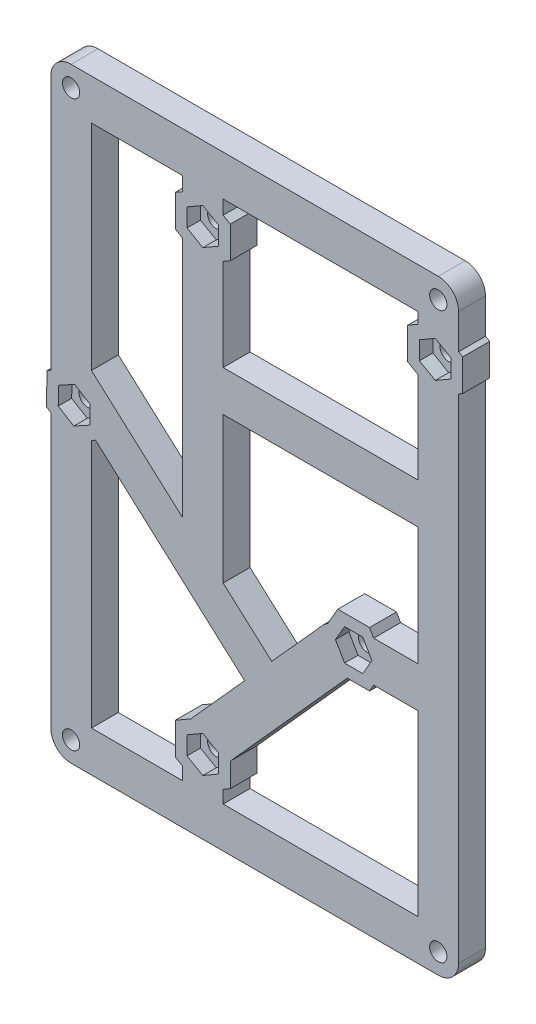
from build123d import *
from build123d.topology import SkipClean

# Parameters (mm, degrees)
SKETCH4_R             = 3.475
SKETCH4_R_2           = 1.475
BOSS_EXTRUDE3_DEPTH   = 2.3
BOSS_EXTRUDE3_2_DEPTH = 2.3
BOSS_EXTRUDE3_3_DEPTH = 2.3
BOSS_EXTRUDE3_4_DEPTH = 2.3
SKETCH2_R             = 3.475
SKETCH2_R_2           = 1.475
BOSS_EXTRUDE4_DEPTH   = 2.3
BOSS_EXTRUDE4_2_DEPTH = 2.3
BOSS_EXTRUDE4_3_DEPTH = 2.3
BOSS_EXTRUDE4_4_DEPTH = 2.3
BOSS_EXTRUDE4_5_DEPTH = 2.3
SKETCH5_R             = 1.475
SKETCH5_R_2           = 3.475
BOSS_EXTRUDE8_DEPTH   = 2.3
BOSS_EXTRUDE9_DEPTH   = 2.3
BOSS_EXTRUDE10_DEPTH  = 2.3
BOSS_EXTRUDE11_DEPTH  = 2.3
BOSS_EXTRUDE12_DEPTH  = 2.3
SKETCH12_W            = 33.31
SKETCH12_H            = 6.95
BOSS_EXTRUDE13_DEPTH  = 2.3
CUT_EXTRUDE1_DEPTH    = 10
BOSS_EXTRUDE15_START  = 2.3
SKETCH16_R            = 3.475
SKETCH16_R_2          = 1.475
BOSS_EXTRUDE15_DEPTH  = 2.3
BOSS_EXTRUDE16_DEPTH  = 2.3
BOSS_EXTRUDE17_START  = 2.3
SKETCH18_R            = 3.475
SKETCH18_R_2          = 1.475
BOSS_EXTRUDE17_DEPTH  = 2.3
CUT_EXTRUDE2_DEPTH    = 2.3
BOSS_EXTRUDE18_DEPTH  = 2.3
BOSS_EXTRUDE19_START  = 2.3
SKETCH22_R            = 1.475
SKETCH22_R_2          = 3.475
BOSS_EXTRUDE19_DEPTH  = 2.3


with BuildPart() as part:
    # Sketch4 → Boss-Extrude3 (new body)
    with BuildSketch(Plane.XY):
        with Locations((-62.78, 96.55)):
            Circle(SKETCH4_R)
        with Locations((-62.78, 96.55)):
            Circle(SKETCH4_R_2, mode=Mode.SUBTRACT)
    extrude(amount=BOSS_EXTRUDE3_DEPTH)



with BuildPart() as body_2:
    # Sketch4 → Boss-Extrude3 2 (new body)
    with BuildSketch(Plane.XY):
        with Locations((0, 96.55)):
            Circle(SKETCH4_R)
        with Locations((0, 96.55)):
            Circle(SKETCH4_R_2, mode=Mode.SUBTRACT)
    extrude(amount=BOSS_EXTRUDE3_2_DEPTH)


with BuildPart() as body_3:
    # Sketch4 → Boss-Extrude3 3 (new body)
    with BuildSketch(Plane.XY):
        with Locations((-62.78, 0)):
            Circle(SKETCH4_R)
        with Locations((-62.78, 0)):
            Circle(SKETCH4_R_2, mode=Mode.SUBTRACT)
    extrude(amount=BOSS_EXTRUDE3_3_DEPTH)


with BuildPart() as body_4:
    # Sketch4 → Boss-Extrude3 4 (new body)
    with BuildSketch(Plane.XY):
        Circle(SKETCH4_R)
        Circle(SKETCH4_R_2, mode=Mode.SUBTRACT)
    extrude(amount=BOSS_EXTRUDE3_4_DEPTH)


with BuildPart() as body_5:
    # Sketch2 → Boss-Extrude4 (new body)
    with BuildSketch(Plane.XY):
        with Locations((-14.46, 37.44)):
            Circle(SKETCH2_R)
        with Locations((-14.46, 37.44)):
            Circle(SKETCH2_R_2, mode=Mode.SUBTRACT)
    extrude(amount=BOSS_EXTRUDE4_DEPTH)


with BuildPart() as body_6:
    # Sketch2 → Boss-Extrude4 2 (new body)
    with BuildSketch(Plane.XY):
        with Locations((-0.52, 87.46)):
            Circle(SKETCH2_R)
        with Locations((-0.52, 87.46)):
            Circle(SKETCH2_R_2, mode=Mode.SUBTRACT)
    extrude(amount=BOSS_EXTRUDE4_2_DEPTH)


with BuildPart() as body_7:
    # Sketch2 → Boss-Extrude4 3 (new body)
    with BuildSketch(Plane.XY):
        with Locations((-40.26, 87.26)):
            Circle(SKETCH2_R)
        with Locations((-40.26, 87.26)):
            Circle(SKETCH2_R_2, mode=Mode.SUBTRACT)
    extrude(amount=BOSS_EXTRUDE4_3_DEPTH)


with BuildPart() as body_8:
    # Sketch2 → Boss-Extrude4 4 (new body)
    with BuildSketch(Plane.XY):
        with Locations((-40.26, 9.09)):
            Circle(SKETCH2_R)
        with Locations((-40.26, 9.09)):
            Circle(SKETCH2_R_2, mode=Mode.SUBTRACT)
    extrude(amount=BOSS_EXTRUDE4_4_DEPTH)


with BuildPart() as body_9:
    # Sketch2 → Boss-Extrude4 5 (new body)
    with BuildSketch(Plane.XY):
        with Locations((-62.25, 49.81)):
            Circle(SKETCH2_R)
        with Locations((-62.25, 49.81)):
            Circle(SKETCH2_R_2, mode=Mode.SUBTRACT)
    extrude(amount=BOSS_EXTRUDE4_5_DEPTH)


with BuildPart() as part_1:
    add(part.part)

    add(body_2.part)  # Boss-Extrude8 merges body 2

    add(body_3.part)  # Boss-Extrude8 merges body 3

    add(body_4.part)  # Boss-Extrude8 merges body 4

    add(body_6.part)  # Boss-Extrude8 merges body 6

    add(body_9.part)  # Boss-Extrude8 merges body 9
    # Sketch5 → Boss-Extrude8 (add)
    # profile 1 of 12: a face of its own
    with BuildSketch(Plane(origin=(0, 0, 0), x_dir=(-1, 0, 0), z_dir=(0, 0, -1))):
        with BuildLine():
            ThreePointArc((0, 93.075), (-2.457196065, 94.092803935), (-3.475, 96.55))
            Line((-3.475, 96.55), (-3.475, 0))
            ThreePointArc((-3.475, 0), (-2.457196065, 2.457196065), (0, 3.475))
            Line((0, 3.475), (3.475, 3.475))
            Line((3.475, 3.475), (3.475, 93.075))
            Line((3.475, 93.075), (0, 93.075))
        make_face()
        with Locations((0.52, 87.46)):
            Circle(SKETCH5_R, mode=Mode.SUBTRACT)
    # profile 2 of 12: a face of its own
    with BuildSketch(Plane(origin=(0, 0, 0), x_dir=(-1, 0, 0), z_dir=(0, 0, -1))):
        with BuildLine():
            Line((62.78, 100.025), (0, 100.025))
            ThreePointArc((0, 100.025), (2.457196065, 99.007196065), (3.475, 96.55))
            Line((3.475, 96.55), (3.475, 93.075))
            Line((3.475, 93.075), (59.305, 93.075))
            Line((59.305, 93.075), (59.305, 96.55))
            ThreePointArc((59.305, 96.55), (60.322803935, 99.007196065), (62.78, 100.025))
        make_face()
    # profile 3 of 12: a face of its own
    with BuildSketch(Plane(origin=(0, 0, 0), x_dir=(-1, 0, 0), z_dir=(0, 0, -1))):
        with BuildLine():
            Line((66.255, 0), (66.255, 96.55))
            ThreePointArc((66.255, 96.55), (65.237196065, 94.092803935), (62.78, 93.075))
            Line((62.78, 93.075), (59.305, 93.075))
            Line((59.305, 93.075), (59.305, 3.475))
            Line((59.305, 3.475), (62.78, 3.475))
            ThreePointArc((62.78, 3.475), (65.237196065, 2.457196065), (66.255, 0))
        make_face()
        with Locations((62.25, 49.81)):
            Circle(SKETCH5_R, mode=Mode.SUBTRACT)
    # profile 4 of 12: a face of its own
    with BuildSketch(Plane(origin=(0, 0, 0), x_dir=(-1, 0, 0), z_dir=(0, 0, -1))):
        with BuildLine():
            ThreePointArc((3.475, 0), (2.457196065, -2.457196065), (0, -3.475))
            Line((0, -3.475), (62.78, -3.475))
            ThreePointArc((62.78, -3.475), (60.322803935, -2.457196065), (59.305, 0))
            Line((59.305, 0), (59.305, 3.475))
            Line((59.305, 3.475), (3.475, 3.475))
            Line((3.475, 3.475), (3.475, 0))
        make_face()
    # profile 5 of 12: a face of its own
    with BuildSketch(Plane(origin=(0, 0, 0), x_dir=(-1, 0, 0), z_dir=(0, 0, -1))):
        with BuildLine():
            ThreePointArc((3.475, 96.55), (2.457196065, 94.092803935), (0, 93.075))
            Line((0, 93.075), (3.475, 93.075))
            Line((3.475, 93.075), (3.475, 96.55))
        make_face()
    # profile 6 of 12: a face of its own
    with BuildSketch(Plane(origin=(0, 0, 0), x_dir=(-1, 0, 0), z_dir=(0, 0, -1))):
        with BuildLine():
            ThreePointArc((62.78, 93.075), (60.322803935, 94.092803935), (59.305, 96.55))
            Line((59.305, 96.55), (59.305, 93.075))
            Line((59.305, 93.075), (62.78, 93.075))
        make_face()
    # profile 7 of 12: a face of its own
    with BuildSketch(Plane(origin=(0, 0, 0), x_dir=(-1, 0, 0), z_dir=(0, 0, -1))):
        with Locations((0, 96.55)):
            Circle(SKETCH5_R_2)
        with Locations((0, 96.55)):
            Circle(SKETCH5_R, mode=Mode.SUBTRACT)
    # profile 8 of 12: a face of its own
    with BuildSketch(Plane(origin=(0, 0, 0), x_dir=(-1, 0, 0), z_dir=(0, 0, -1))):
        with Locations((62.78, 96.55)):
            Circle(SKETCH5_R_2)
        with Locations(Location((62.78, 96.55, 0), (0, 0, 180))):
            Circle(SKETCH5_R, mode=Mode.SUBTRACT)
    # profile 9 of 12: a face of its own
    with BuildSketch(Plane(origin=(0, 0, 0), x_dir=(-1, 0, 0), z_dir=(0, 0, -1))):
        Circle(SKETCH5_R_2)
        Circle(SKETCH5_R, mode=Mode.SUBTRACT)
    # profile 10 of 12: a face of its own
    with BuildSketch(Plane(origin=(0, 0, 0), x_dir=(-1, 0, 0), z_dir=(0, 0, -1))):
        with BuildLine():
            Line((3.475, 3.475), (0, 3.475))
            ThreePointArc((0, 3.475), (2.457196065, 2.457196065), (3.475, 0))
            Line((3.475, 0), (3.475, 3.475))
        make_face()
    # profile 11 of 12: a face of its own
    with BuildSketch(Plane(origin=(0, 0, 0), x_dir=(-1, 0, 0), z_dir=(0, 0, -1))):
        with Locations((62.78, 0)):
            Circle(SKETCH5_R_2)
        with Locations((62.78, 0)):
            Circle(SKETCH5_R, mode=Mode.SUBTRACT)
    # profile 12 of 12: a face of its own
    with BuildSketch(Plane(origin=(0, 0, 0), x_dir=(-1, 0, 0), z_dir=(0, 0, -1))):
        with BuildLine():
            Line((62.78, 3.475), (59.305, 3.475))
            Line((59.305, 3.475), (59.305, 0))
            ThreePointArc((59.305, 0), (60.322803935, 2.457196065), (62.78, 3.475))
        make_face()
    extrude(amount=-BOSS_EXTRUDE8_DEPTH)


    add(body_5.part)  # Boss-Extrude9 merges body 5

    add(body_7.part)  # Boss-Extrude9 merges body 7

    add(body_8.part)  # Boss-Extrude9 merges body 8
    # Sketch7 → Boss-Extrude9 (add)
    with BuildSketch(Plane(origin=(0, 0, 0), x_dir=(-1, 0, 0), z_dir=(0, 0, -1))):
        with BuildLine():
            Line((36.785, 93.075), (36.785, 87.26))
            ThreePointArc((36.785, 87.26), (40.26, 90.735), (43.735, 87.26))
            Line((43.735, 87.26), (43.735, 93.075))
            Line((43.735, 93.075), (36.785, 93.075))
        make_face()
        with BuildLine():
            Line((3.475, 33.965), (14.46, 33.965))
            ThreePointArc((14.46, 33.965), (10.985, 37.44), (14.46, 40.915))
            Line((14.46, 40.915), (3.475, 40.915))
            Line((3.475, 40.915), (3.475, 33.965))
        make_face()
        with BuildLine():
            Line((43.735, 3.475), (43.735, 9.09))
            ThreePointArc((43.735, 9.09), (40.26, 5.615), (36.785, 9.09))
            Line((36.785, 9.09), (36.785, 3.475))
            Line((36.785, 3.475), (43.735, 3.475))
        make_face()
    extrude(amount=-BOSS_EXTRUDE9_DEPTH)

    # Sketch8 → Boss-Extrude10 (add)
    with BuildSketch(Plane(origin=(0, 0, 0), x_dir=(-1, 0, 0), z_dir=(0, 0, -1))):
        with BuildLine():
            Line((14.46, 33.965), (36.785, 9.09))
            ThreePointArc((36.785, 9.09), (39.654572859, 12.511853734), (43.524040562, 10.282335611))
            ThreePointArc((43.524040562, 10.282335611), (42.905573582, 12.082105699), (41.957351355, 13.732120362))
            Line((41.957351355, 13.732120362), (19.632351355, 38.607120362))
            ThreePointArc((19.632351355, 38.607120362), (17.841296787, 39.827777652), (15.829298749, 40.633845008))
            ThreePointArc((15.829298749, 40.633845008), (17.863985635, 36.741067386), (14.46, 33.965))
        make_face()
    extrude(amount=-BOSS_EXTRUDE10_DEPTH)

    # Sketch9 → Boss-Extrude11 (add)
    with BuildSketch(Plane(origin=(0, 0, 0), x_dir=(-1, 0, 0), z_dir=(0, 0, -1))):
        with BuildLine():
            Line((59.305, 56.426418634), (28.473791174, 28.75579604))
            Line((28.473791174, 28.75579604), (33.115911536, 23.583444684))
            Line((33.115911536, 23.583444684), (59.305, 47.087822572))
            Line((59.305, 47.087822572), (59.305, 47.965386219))
            ThreePointArc((59.305, 47.965386219), (58.775, 49.81), (59.305, 51.654613781))
            Line((59.305, 51.654613781), (59.305, 56.426418634))
        make_face()
    extrude(amount=-BOSS_EXTRUDE11_DEPTH)

    # Sketch10 → Boss-Extrude12 (add)
    with BuildSketch(Plane(origin=(0, 0, 0), x_dir=(-1, 0, 0), z_dir=(0, 0, -1))):
        with BuildLine():
            ThreePointArc((43.735, 87.26), (40.26, 83.785), (36.785, 87.26))
            Line((36.785, 87.26), (36.785, 36.215001549))
            Line((36.785, 36.215001549), (43.735, 42.452539237))
            Line((43.735, 42.452539237), (43.735, 87.26))
        make_face()
    extrude(amount=-BOSS_EXTRUDE12_DEPTH)

    # Sketch12 → Boss-Extrude13 (add)
    with BuildSketch(Plane.XY.offset(2.3)):
        with Locations((-20.13, 64.645000774)):
            Rectangle(SKETCH12_W, SKETCH12_H)
    extrude(amount=-BOSS_EXTRUDE13_DEPTH)

    # Sketch13 → Cut-Extrude1 (cut)
    with BuildSketch(Plane.XY.offset(2.3)):
        Polygon((-11.342308546, 37.44), (-12.901154273, 40.14), (-16.018845727, 40.14), (-17.577691454, 37.44), (-16.018845727, 34.74), (-12.901154273, 34.74), align=None)
        Polygon((-40.26, 5.972308546), (-37.56, 7.531154273), (-37.56, 10.648845727), (-40.26, 12.207691454), (-42.96, 10.648845727), (-42.96, 7.531154273), align=None)
        Polygon((-40.26, 90.377691454), (-42.96, 88.818845727), (-42.96, 85.701154273), (-40.26, 84.142308546), (-37.56, 85.701154273), (-37.56, 88.818845727), align=None)
        Polygon((-0.52, 90.577691454), (-3.22, 89.018845727), (-3.22, 85.901154273), (-0.52, 84.342308546), (2.18, 85.901154273), (2.18, 89.018845727), align=None)
    extrude(amount=-CUT_EXTRUDE1_DEPTH, mode=Mode.SUBTRACT)

    # Sketch16 → Boss-Extrude15 (add)
    # profile 1 of 4: a face of its own
    with SkipClean():  # the faces are left unmerged after this step: merging them gives an invalid solid
        with BuildSketch(Plane(origin=(0, 0, 0), x_dir=(-1, 0, 0), z_dir=(0, 0, -1)).offset(BOSS_EXTRUDE15_START)):
            with Locations((0.52, 87.46)):
                Circle(SKETCH16_R)
            with Locations((0.52, 87.46)):
                Circle(SKETCH16_R_2, mode=Mode.SUBTRACT)
        # profile 2 of 4: a face of its own
        with BuildSketch(Plane(origin=(0, 0, 0), x_dir=(-1, 0, 0), z_dir=(0, 0, -1)).offset(BOSS_EXTRUDE15_START)):
            with Locations((40.26, 87.26)):
                Circle(SKETCH16_R)
            with Locations((40.26, 87.26)):
                Circle(SKETCH16_R_2, mode=Mode.SUBTRACT)
        # profile 3 of 4: a face of its own
        with BuildSketch(Plane(origin=(0, 0, 0), x_dir=(-1, 0, 0), z_dir=(0, 0, -1)).offset(BOSS_EXTRUDE15_START)):
            with Locations((14.46, 37.44)):
                Circle(SKETCH16_R)
            with Locations((14.46, 37.44)):
                Circle(SKETCH16_R_2, mode=Mode.SUBTRACT)
        # profile 4 of 4: a face of its own
        with BuildSketch(Plane(origin=(0, 0, 0), x_dir=(-1, 0, 0), z_dir=(0, 0, -1)).offset(BOSS_EXTRUDE15_START)):
            with Locations((40.26, 9.09)):
                Circle(SKETCH16_R)
            with Locations((40.26, 9.09)):
                Circle(SKETCH16_R_2, mode=Mode.SUBTRACT)
        extrude(amount=-BOSS_EXTRUDE15_DEPTH)

    # Sketch17 → Boss-Extrude16 (add)
    # profile 1 of 4: a face of its own
    with BuildSketch(Plane.XY.offset(2.3)):
        Polygon((-35.56, 6.376453735), (-35.56, 11.803546265), (-40.26, 14.51709253), (-44.96, 11.803546265), (-44.96, 6.376453735), (-40.26, 3.66290747), align=None)
        Polygon((-37.56, 7.531154273), (-37.56, 10.648845727), (-40.26, 12.207691454), (-42.96, 10.648845727), (-42.96, 7.531154273), (-40.26, 5.972308546), align=None, mode=Mode.SUBTRACT)
    # profile 2 of 4: a face of its own
    with BuildSketch(Plane.XY.offset(2.3)):
        Polygon((-19.88709253, 37.44), (-17.173546265, 32.74), (-11.746453735, 32.74), (-9.03290747, 37.44), (-11.746453735, 42.14), (-17.173546265, 42.14), align=None)
        Polygon((-11.342308546, 37.44), (-12.901154273, 40.14), (-16.018845727, 40.14), (-17.577691454, 37.44), (-16.018845727, 34.74), (-12.901154273, 34.74), align=None, mode=Mode.SUBTRACT)
    # profile 3 of 4: a face of its own
    with BuildSketch(Plane.XY.offset(2.3)):
        Polygon((-5.22, 84.746453735), (-0.52, 82.03290747), (4.18, 84.746453735), (4.18, 90.173546265), (-0.52, 92.88709253), (-5.22, 90.173546265), align=None)
        Polygon((-0.52, 84.342308546), (2.18, 85.901154273), (2.18, 89.018845727), (-0.52, 90.577691454), (-3.22, 89.018845727), (-3.22, 85.901154273), align=None, mode=Mode.SUBTRACT)
    # profile 4 of 4: a face of its own
    with BuildSketch(Plane.XY.offset(2.3)):
        Polygon((-40.26, 81.83290747), (-35.56, 84.546453735), (-35.56, 89.973546265), (-40.26, 92.68709253), (-44.96, 89.973546265), (-44.96, 84.546453735), align=None)
        Polygon((-37.56, 85.701154273), (-37.56, 88.818845727), (-40.26, 90.377691454), (-42.96, 88.818845727), (-42.96, 85.701154273), (-40.26, 84.142308546), align=None, mode=Mode.SUBTRACT)
    extrude(amount=-BOSS_EXTRUDE16_DEPTH)

    # Sketch18 → Boss-Extrude17 (add)
    with SkipClean():  # the faces are left unmerged after this step: merging them gives an invalid solid
        with BuildSketch(Plane(origin=(0, 0, 0), x_dir=(-1, 0, 0), z_dir=(0, 0, -1)).offset(BOSS_EXTRUDE17_START)):
            with Locations(Location((62.25, 49.81, 0), (0, 0, 180))):
                Circle(SKETCH18_R)
            with Locations((62.25, 49.81)):
                Circle(SKETCH18_R_2, mode=Mode.SUBTRACT)
        extrude(amount=-BOSS_EXTRUDE17_DEPTH)

    # Sketch19 → Cut-Extrude2 (cut)
    with BuildSketch(Plane.XY.offset(2.3)):
        Polygon((-59.518544223, 51.313046685), (-62.185948724, 52.927033435), (-64.917404501, 51.423986749), (-64.981455777, 48.306953315), (-62.314051276, 46.692966565), (-59.582595499, 48.196013251), align=None)
    extrude(amount=-CUT_EXTRUDE2_DEPTH, mode=Mode.SUBTRACT)

    # Sketch20 → Boss-Extrude18 (add)
    with BuildSketch(Plane.XY.offset(2.3)):
        Polygon((-57.606740313, 47.00046751), (-57.495243648, 52.426414601), (-62.138503335, 55.23594709), (-66.893259687, 52.61953249), (-67.004756352, 47.193585399), (-62.361496665, 44.38405291), align=None)
        Polygon((-59.582595499, 48.196013251), (-59.518544223, 51.313046685), (-62.185948724, 52.927033435), (-64.917404501, 51.423986749), (-64.981455777, 48.306953315), (-62.314051276, 46.692966565), align=None, mode=Mode.SUBTRACT)
    extrude(amount=-BOSS_EXTRUDE18_DEPTH)

    # Sketch22 → Boss-Extrude19 (add)
    with SkipClean():  # the faces are left unmerged after this step: merging them gives an invalid solid
        with BuildSketch(Plane(origin=(0, 0, 0), x_dir=(-1, 0, 0), z_dir=(0, 0, -1)).offset(BOSS_EXTRUDE19_START)):
            with BuildLine():
                Line((-3.475, 84.339421795), (-3.475, 0))
                ThreePointArc((-3.475, 0), (-2.457196065, -2.457196065), (0, -3.475))
                Line((0, -3.475), (62.78, -3.475))
                ThreePointArc((62.78, -3.475), (65.237196065, -2.457196065), (66.255, 0))
                Line((66.255, 0), (66.255, 46.739924615))
                Line((66.255, 46.739924615), (67.004756352, 47.193585399))
                Line((67.004756352, 47.193585399), (66.893259687, 52.61953249))
                Line((66.893259687, 52.61953249), (66.255, 52.970749638))
                Line((66.255, 52.970749638), (66.255, 96.55))
                ThreePointArc((66.255, 96.55), (65.237196065, 99.007196065), (62.78, 100.025))
                Line((62.78, 100.025), (0, 100.025))
                ThreePointArc((0, 100.025), (-2.457196065, 99.007196065), (-3.475, 96.55))
                Line((-3.475, 96.55), (-3.475, 90.580578205))
                Line((-3.475, 90.580578205), (-4.18, 90.173546265))
                Line((-4.18, 90.173546265), (-4.18, 84.746453735))
                Line((-4.18, 84.746453735), (-3.475, 84.339421795))
            make_face()
            with Locations((0, 96.55)):
                Circle(SKETCH22_R, mode=Mode.SUBTRACT)
            Circle(SKETCH22_R, mode=Mode.SUBTRACT)
            with Locations((62.78, 0)):
                Circle(SKETCH22_R, mode=Mode.SUBTRACT)
            with Locations((40.26, 9.09)):
                Circle(SKETCH22_R_2, mode=Mode.SUBTRACT)
            with Locations((62.25, 49.81)):
                Circle(SKETCH22_R_2, mode=Mode.SUBTRACT)
            with Locations((14.46, 37.44)):
                Circle(SKETCH22_R_2, mode=Mode.SUBTRACT)
            with Locations((40.26, 87.26)):
                Circle(SKETCH22_R_2, mode=Mode.SUBTRACT)
            with Locations((0.52, 87.46)):
                Circle(SKETCH22_R_2, mode=Mode.SUBTRACT)
            with Locations((62.78, 96.55)):
                Circle(SKETCH22_R, mode=Mode.SUBTRACT)
            Polygon((3.475, 3.475), (36.785, 3.475), (36.785, 5.669199655), (35.56, 6.376453735), (35.56, 10.454921613), (15.559422111, 32.74), (11.746453735, 32.74), (11.039199655, 33.965), (3.475, 33.965), align=None, mode=Mode.SUBTRACT)
            with BuildLine():
                Line((43.735, 3.475), (59.305, 3.475))
                Line((59.305, 3.475), (59.305, 46.065960858))
                Line((59.305, 46.065960858), (58.59917768, 46.454355907))
                Line((58.59917768, 46.454355907), (33.115911536, 23.583444684))
                Line((33.115911536, 23.583444684), (41.957351355, 13.732120362))
                ThreePointArc((41.957351355, 13.732120362), (42.068172136, 13.572602496), (42.175873765, 13.410962296))
                Line((42.175873765, 13.410962296), (44.96, 11.803546265))
                Line((44.96, 11.803546265), (44.96, 6.376453735))
                Line((44.96, 6.376453735), (43.735, 5.669199655))
                Line((43.735, 5.669199655), (43.735, 3.475))
            make_face(mode=Mode.SUBTRACT)
            Polygon((43.735, 42.452539237), (59.305, 56.426418634), (59.305, 93.075), (43.735, 93.075), (43.735, 90.680800345), (44.96, 89.973546265), (44.96, 84.546453735), (43.735, 83.839199655), align=None, mode=Mode.SUBTRACT)
            with BuildLine():
                Line((11.039199655, 40.915), (3.475, 40.915))
                Line((3.475, 40.915), (3.475, 61.170000774))
                Line((3.475, 61.170000774), (36.785, 61.170000774))
                Line((36.785, 61.170000774), (36.785, 36.215001549))
                Line((36.785, 36.215001549), (28.473791174, 28.75579604))
                Line((28.473791174, 28.75579604), (19.632351355, 38.607120362))
                ThreePointArc((19.632351355, 38.607120362), (19.260434162, 38.90962376), (18.874446312, 39.193954701))
                Line((18.874446312, 39.193954701), (17.173546265, 42.14))
                Line((17.173546265, 42.14), (11.746453735, 42.14))
                Line((11.746453735, 42.14), (11.039199655, 40.915))
            make_face(mode=Mode.SUBTRACT)
            Polygon((36.785, 68.120000774), (3.475, 68.120000774), (3.475, 83.738977515), (5.22, 84.746453735), (5.22, 90.173546265), (3.475, 91.181022485), (3.475, 93.075), (36.785, 93.075), (36.785, 90.680800345), (35.56, 89.973546265), (35.56, 84.546453735), (36.785, 83.839199655), align=None, mode=Mode.SUBTRACT)
        extrude(amount=-BOSS_EXTRUDE19_DEPTH)


solid = part_1.part
